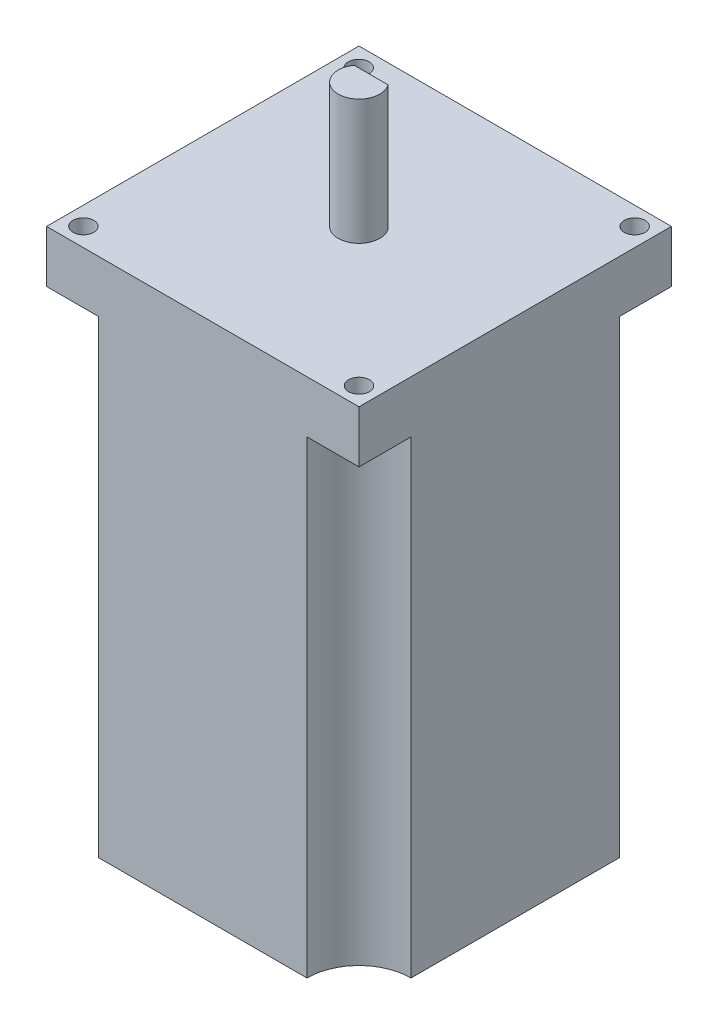
from build123d import *

# Parameters (mm, degrees)
BOSS_EXTRUDE3_DEPTH = 90
SKETCH3_W           = 60
SKETCH3_H           = 60
BOSS_EXTRUDE4_DEPTH = 10
BOSS_EXTRUDE5_DEPTH = 24
CUT_EXTRUDE1_REACH  = 101.499
SKETCH6_R           = 2
CUT_EXTRUDE2_REACH  = 101.499
SKETCH7_R           = 2
CUT_EXTRUDE3_REACH  = 101.499
SKETCH9_R           = 2
CUT_EXTRUDE4_REACH  = 101.499
SKETCH10_R          = 2


with BuildPart() as part:
    # Sketch1 → Boss-Extrude3 (new body)
    with BuildSketch(Plane(origin=(0, 0, 0), x_dir=(1, 0, 0), z_dir=(0, 1, 0))):
        with BuildLine():
            Line((-20, 30), (20, 30))
            ThreePointArc((20, 30), (22.928932188, 22.928932188), (30, 20))
            Line((30, 20), (30, -20))
            ThreePointArc((30, -20), (22.928932188, -22.928932188), (20, -30))
            Line((20, -30), (-20, -30))
            ThreePointArc((-20, -30), (-22.928932188, -22.928932188), (-30, -20))
            Line((-30, -20), (-30, 20))
            ThreePointArc((-30, 20), (-22.928932188, 22.928932188), (-20, 30))
        make_face()
    extrude(amount=BOSS_EXTRUDE3_DEPTH)

    # Sketch3 → Boss-Extrude4 (add)
    with BuildSketch(Plane(origin=(0, 90, 0), x_dir=(1, 0, 0), z_dir=(0, 1, 0))):
        Rectangle(SKETCH3_W, SKETCH3_H)
    extrude(amount=BOSS_EXTRUDE4_DEPTH)

    # Sketch4 → Boss-Extrude5 (add)
    with BuildSketch(Plane(origin=(0, 100, 0), x_dir=(1, 0, 0), z_dir=(0, 1, 0))):
        with BuildLine():
            Line((-3.25, 2.331844763), (3.25, 2.331844763))
            ThreePointArc((3.25, 2.331844763), (0, -4), (-3.25, 2.331844763))
        make_face()
    extrude(amount=BOSS_EXTRUDE5_DEPTH)

    # Sketch6 → Cut-Extrude1 (cut, up to next)
    with BuildSketch(Plane.XZ.offset(-90), mode=Mode.PRIVATE) as cut_extrude1_sk1:
        with Locations(Location((-26.408079858, -26.352396966, 0), (0, 0, 270))):
            Circle(SKETCH6_R)
    cut_extrude1_tool1 = extrude(cut_extrude1_sk1.sketch, amount=-CUT_EXTRUDE1_REACH, mode=Mode.PRIVATE) & part.part
    add(cut_extrude1_tool1.solids().sort_by_distance((-26.40808, 90, -26.352397))[0], mode=Mode.SUBTRACT)

    # Sketch7 → Cut-Extrude2 (cut, up to next)
    with BuildSketch(Plane.XZ.offset(-90), mode=Mode.PRIVATE) as cut_extrude2_sk1:
        with Locations(Location((-26.47347716, 26.455477937, 0), (0, 0, 270))):
            Circle(SKETCH7_R)
    cut_extrude2_tool1 = extrude(cut_extrude2_sk1.sketch, amount=-CUT_EXTRUDE2_REACH, mode=Mode.PRIVATE) & part.part
    add(cut_extrude2_tool1.solids().sort_by_distance((-26.473477, 90, 26.455478))[0], mode=Mode.SUBTRACT)

    # Sketch9 → Cut-Extrude3 (cut, up to next)
    with BuildSketch(Plane.XZ.offset(-90), mode=Mode.PRIVATE) as cut_extrude3_sk1:
        with Locations(Location((26.496913455, 26.496913455, 0), (0, 0, 270))):
            Circle(SKETCH9_R)
    cut_extrude3_tool1 = extrude(cut_extrude3_sk1.sketch, amount=-CUT_EXTRUDE3_REACH, mode=Mode.PRIVATE) & part.part
    add(cut_extrude3_tool1.solids().sort_by_distance((26.496913, 90, 26.496913))[0], mode=Mode.SUBTRACT)

    # Sketch10 → Cut-Extrude4 (cut, up to next)
    with BuildSketch(Plane.XZ.offset(-90), mode=Mode.PRIVATE) as cut_extrude4_sk1:
        with Locations(Location((26.464466094, -26.464466094, 0), (0, 0, 270))):
            Circle(SKETCH10_R)
    cut_extrude4_tool1 = extrude(cut_extrude4_sk1.sketch, amount=-CUT_EXTRUDE4_REACH, mode=Mode.PRIVATE) & part.part
    add(cut_extrude4_tool1.solids().sort_by_distance((26.464466, 90, -26.464466))[0], mode=Mode.SUBTRACT)


solid = part.part
